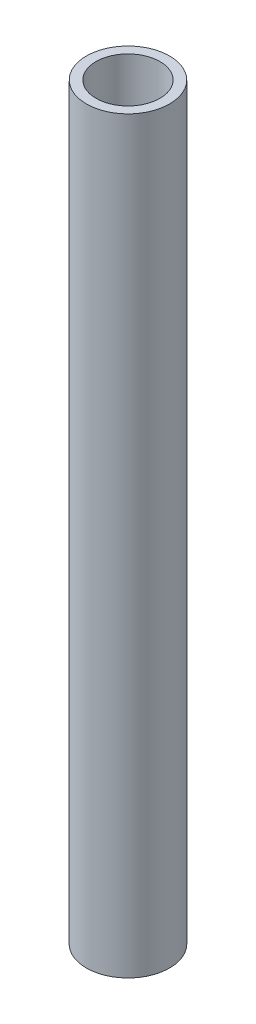
from build123d import *

# Parameters (mm, degrees)
SKETCH1_R           = 6.35
SKETCH1_R_2         = 4.8768
BOSS_EXTRUDE1_DEPTH = 114.3


with BuildPart() as part:
    # Sketch1 → Boss-Extrude1 (new body)
    with BuildSketch(Plane(origin=(0, 0, 0), x_dir=(1, 0, 0), z_dir=(0, 1, 0))):
        with Locations(Location((0, 0, 0), (0, 0, 270))):
            Circle(SKETCH1_R)
        with Locations(Location((0, 0, 0), (0, 0, 270))):
            Circle(SKETCH1_R_2, mode=Mode.SUBTRACT)
    extrude(amount=BOSS_EXTRUDE1_DEPTH)


solid = part.part
